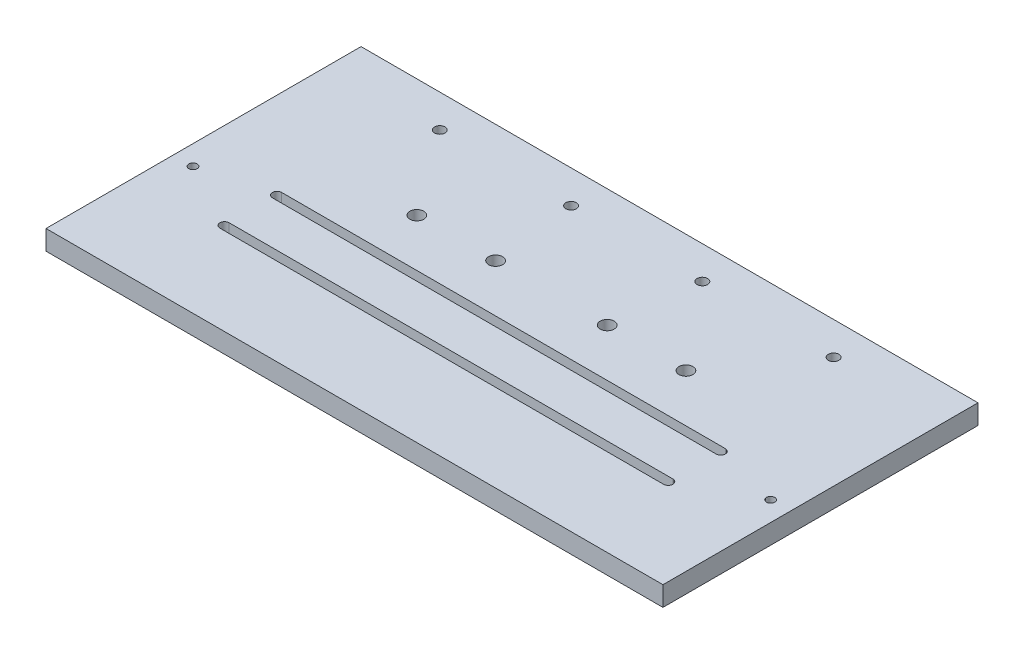
from build123d import *

# Parameters (mm, degrees)
SKETCH1_W               = 298.45
SKETCH1_H               = 152.4
BOSS_EXTRUDE1_DEPTH     = 4.7625
CUT_EXTRUDE2_DEPTH      = 168.825106137
F_10_CLEARANCE_HOLE3_D  = 5.1054
LPATTERN2_COUNT         = 4
LPATTERN2_PITCH         = 63.5
F_10_32_TAPPED_HOLE1_D  = 4.0386
F_1_4_CLEARANCE_HOLE1_D = 6.7564


with BuildPart() as part:
    # Sketch1 → Boss-Extrude1 (new, symmetric)
    with BuildSketch(Plane(origin=(0, 0, 0), x_dir=(1, 0, 0), z_dir=(0, 1, 0))):
        Rectangle(SKETCH1_W, SKETCH1_H)
    extrude(amount=BOSS_EXTRUDE1_DEPTH, both=True)

    # Sketch4 → Cut-Extrude2 (cut, through all)
    with BuildSketch(Plane.XZ.offset(4.7625)):
        with BuildLine():
            Line((-107.315, 33.9979), (107.315, 33.9979))
            ThreePointArc((107.315, 33.9979), (109.5629, 31.75), (107.315, 29.5021))
            Line((107.315, 29.5021), (-107.315, 29.5021))
            ThreePointArc((-107.315, 29.5021), (-109.5629, 31.75), (-107.315, 33.9979))
        make_face()
        with BuildLine():
            Line((-107.315, 8.5979), (107.315, 8.5979))
            ThreePointArc((107.315, 8.5979), (109.5629, 6.35), (107.315, 4.1021))
            Line((107.315, 4.1021), (-107.315, 4.1021))
            ThreePointArc((-107.315, 4.1021), (-109.5629, 6.35), (-107.315, 8.5979))
        make_face()
    extrude(amount=-CUT_EXTRUDE2_DEPTH, mode=Mode.SUBTRACT)

    # #10 Clearance Hole3 (through all)
    with Locations(Plane(origin=(0, 4.7625, 0), x_dir=(1, 0, 0), z_dir=(0, 1, 0))):
        with Locations((-95.25, 60.325)):
            f_10_clearance_hole3 = Hole(F_10_CLEARANCE_HOLE3_D / 2)

    # LPattern2: #10 Clearance Hole3 ×4
    with Locations(*[(i * LPATTERN2_PITCH, 0, 0) for i in range(1, LPATTERN2_COUNT)]):
        add(f_10_clearance_hole3, mode=Mode.SUBTRACT)

    # #10-32 Tapped Hole1 (through all)
    with Locations(Plane(origin=(0, 4.7625, 0), x_dir=(1, 0, 0), z_dir=(0, 1, 0))):
        with Locations((-139.7, -14.605), (139.7, -14.605)):
            Hole(F_10_32_TAPPED_HOLE1_D / 2)

    # 1/4 Clearance Hole1 (through all)
    with Locations(Plane(origin=(0, 4.7625, 0), x_dir=(1, 0, 0), z_dir=(0, 1, 0))):
        with Locations((-65.0875, 19.05), (-26.9875, 19.05)):
            f_1_4_clearance_hole1 = Hole(F_1_4_CLEARANCE_HOLE1_D / 2)

    # Mirror5: 1/4 Clearance Hole1 across plane
    add(f_1_4_clearance_hole1.mirror(Plane(origin=(0, 0, 0), x_dir=(0, 0, 1), z_dir=(1, 0, 0))), mode=Mode.SUBTRACT)


solid = part.part
